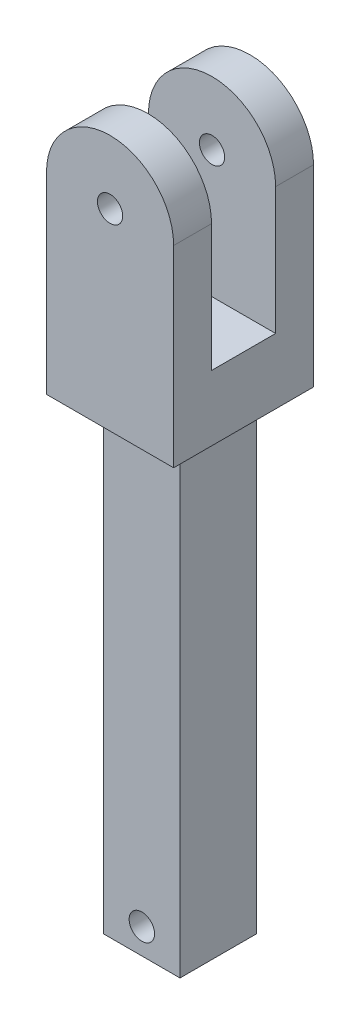
from build123d import *
from build123d.topology import SkipClean

# Parameters (mm, degrees)
SKETCH_1_R          = 1.985
EXTRUDE_1_DEPTH     = 12
CUT_EXTRUDE_1_DEPTH = 39.218600963
CUT_EXTRUDE_6_DEPTH = 39.218600963
SKETCH_12_R         = 1.985
EXTRUDE_11_DEPTH    = 5
EXTRUDE_START       = 5
SKETCH_13_R         = 1.985
EXTRUDE_12_DEPTH    = 5
SKETCH_14_W         = 2.04
SKETCH_14_H         = 20
CUT_EXTRUDE_7_DEPTH = 41.070705753
SKETCH_15_W         = 6
SKETCH_15_H         = 6
EXTRUDE_13_DEPTH    = 74
SKETCH_17_R         = 2
CUT_EXTRUDE_8_DEPTH = 107.125262104


with BuildPart() as part:
    # 草圖1 → 填料-伸長1 (new body)
    with BuildSketch(Plane.XY):
        with BuildLine():
            Line((-10, 0), (-10, -30.276417548))
            Line((-10, -30.276417548), (10, -30.276417548))
            Line((10, -30.276417548), (10, 0))
            ThreePointArc((10, 0), (0, 10), (-10, 0))
        make_face()
        Circle(SKETCH_1_R, mode=Mode.SUBTRACT)
    extrude(amount=EXTRUDE_1_DEPTH)

    # 草圖2 → 除料-伸長1 (cut, through all)
    with BuildSketch(Plane(origin=(10, 0, 0), x_dir=(0, 0, -1), z_dir=(1, 0, 0))):
        Polygon((-9, 0), (-6, 0), (-3, 0), (-3, 15.780779257), (-9, 15.780779257), align=None)
        Polygon((-3, 0), (-6, 0), (-9, 0), (-8.60053373, -20), (-3, -20), align=None)
    extrude(amount=-CUT_EXTRUDE_1_DEPTH, mode=Mode.SUBTRACT)

    # 草圖11 → 除料-伸長6 (cut, through all)
    with BuildSketch(Plane(origin=(10, 0, 0), x_dir=(0, 0, -1), z_dir=(1, 0, 0))):
        Polygon((-9, 0), (-9, -20), (-8.60053373, -20), align=None)
    extrude(amount=-CUT_EXTRUDE_6_DEPTH, mode=Mode.SUBTRACT)

    # 草圖12 → 填料-伸長11 (add)
    # profile 1 of 2: a face of its own
    with BuildSketch(Plane.XY.offset(12)):
        with BuildLine():
            ThreePointArc((10, 0), (0, 10), (-10, 0))
            ThreePointArc((-10, 0), (0, -10), (10, 0))
        make_face()
        Circle(SKETCH_12_R, mode=Mode.SUBTRACT)
    # profile 2 of 2: a face of its own
    with BuildSketch(Plane.XY.offset(12)):
        with BuildLine():
            ThreePointArc((10, 0), (0, -10), (-10, 0))
            Line((-10, 0), (-10, -30.276417548))
            Line((-10, -30.276417548), (10, -30.276417548))
            Line((10, -30.276417548), (10, 0))
        make_face()
    extrude(amount=EXTRUDE_11_DEPTH)

    # 草圖13 → 填料-伸長12 (add)
    # profile 1 of 2: a face of its own
    with SkipClean():  # the faces are left unmerged after this step: merging them gives an invalid solid
        with BuildSketch(Plane(origin=(0, 0, 0), x_dir=(-1, 0, 0), z_dir=(0, 0, -1)).offset(EXTRUDE_START)):
            with BuildLine():
                ThreePointArc((10, 0), (0, 10), (-10, 0))
                ThreePointArc((-10, 0), (0, -10), (10, 0))
            make_face()
            Circle(SKETCH_13_R, mode=Mode.SUBTRACT)
        # profile 2 of 2: a face of its own
        with BuildSketch(Plane(origin=(0, 0, 0), x_dir=(-1, 0, 0), z_dir=(0, 0, -1)).offset(EXTRUDE_START)):
            with BuildLine():
                ThreePointArc((10, 0), (0, -10), (-10, 0))
                Line((-10, 0), (-10, -30.276417548))
                Line((-10, -30.276417548), (10, -30.276417548))
                Line((10, -30.276417548), (10, 0))
            make_face()
        extrude(amount=-EXTRUDE_12_DEPTH)

    # 草圖14 → 除料-伸長7 (cut, through all)
    with SkipClean():  # the faces are left unmerged after this step: merging them gives an invalid solid
        with BuildSketch(Plane.ZY.offset(10)):
            Polygon((3, 0), (3, -20), (9, -20), (9, 0), (11.04, 0), (11.04, 10), (3, 10), (0.96, 10), (0.96, 0), align=None)
            with Locations((1.98, -10)):
                Rectangle(SKETCH_14_W, SKETCH_14_H)
            with Locations((10.02, -10)):
                Rectangle(SKETCH_14_W, SKETCH_14_H)
        extrude(amount=-CUT_EXTRUDE_7_DEPTH, mode=Mode.SUBTRACT)

    # 草圖15 → 填料-伸長13 (add)
    with SkipClean():  # the faces are left unmerged after this step: merging them gives an invalid solid
        with BuildSketch(Plane.XZ.offset(30.276417548)):
            with Locations((3, 9)):
                Rectangle(SKETCH_15_W, SKETCH_15_H)
            with Locations((-3, 9)):
                Rectangle(SKETCH_15_W, SKETCH_15_H)
            with Locations((3, 3)):
                Rectangle(SKETCH_15_W, SKETCH_15_H)
            with Locations((-3, 3)):
                Rectangle(SKETCH_15_W, SKETCH_15_H)
        extrude(amount=EXTRUDE_13_DEPTH)

    # 草圖17 → 除料-伸長8 (cut, through all)
    with SkipClean():  # the faces are left unmerged after this step: merging them gives an invalid solid
        with BuildSketch(Plane(origin=(0, 0, 0), x_dir=(-1, 0, 0), z_dir=(0, 0, -1))):
            with Locations((0, -100.276417548)):
                Circle(SKETCH_17_R)
        extrude(amount=-CUT_EXTRUDE_8_DEPTH, mode=Mode.SUBTRACT)


solid = part.part
